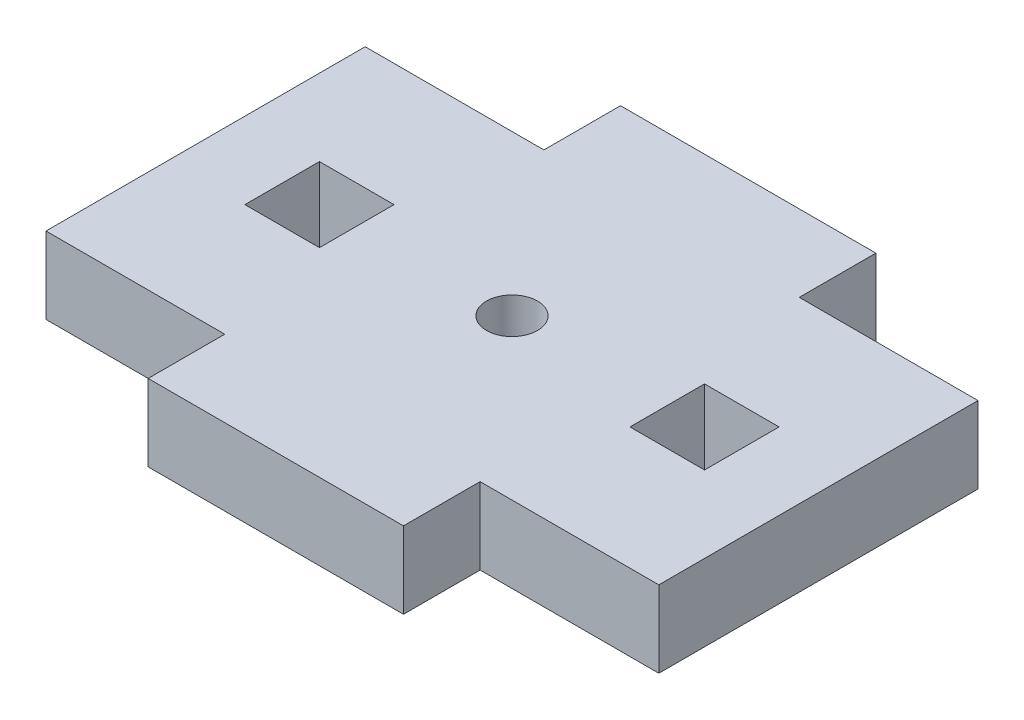
from build123d import *

# Parameters (mm, degrees)
SKETCH1_W           = 10
SKETCH1_H           = 3
BOSS_EXTRUDE1_DEPTH = 3


with BuildPart() as part:
    # Sketch1 → Boss-Extrude1 (new body)
    with BuildSketch(Plane(origin=(0, 0, 0), x_dir=(1, 0, 0), z_dir=(0, 1, 0))):
        with BuildLine():
            Line((9.900990099, -7.357973937), (9.900990099, -1.107973937))
            Line((9.900990099, -1.107973937), (6.900990099, -1.107973937))
            Line((6.900990099, -1.107973937), (6.900990099, -2.567973937))
            Line((6.900990099, -2.567973937), (3.980990099, -2.567973937))
            Line((3.980990099, -2.567973937), (3.980990099, -1.107973937))
            Line((3.980990099, -1.107973937), (-1.099009901, -1.107973937))
            ThreePointArc((-1.099009901, -1.107973937), (-2.099009901, -2.107973937), (-3.099009901, -1.107973937))
            Line((-3.099009901, -1.107973937), (-8.179009901, -1.107973937))
            Line((-8.179009901, -1.107973937), (-8.179009901, -2.567973937))
            Line((-8.179009901, -2.567973937), (-11.099009901, -2.567973937))
            Line((-11.099009901, -2.567973937), (-11.099009901, -1.107973937))
            Line((-11.099009901, -1.107973937), (-14.099009901, -1.107973937))
            Line((-14.099009901, -1.107973937), (-14.099009901, -7.357973937))
            Line((-14.099009901, -7.357973937), (-7.099009901, -7.357973937))
            Line((-7.099009901, -7.357973937), (2.900990099, -7.357973937))
            Line((2.900990099, -7.357973937), (9.900990099, -7.357973937))
        make_face()
        with BuildLine():
            Line((9.900990099, 5.142026063), (2.900990099, 5.142026063))
            Line((2.900990099, 5.142026063), (-7.099009901, 5.142026063))
            Line((-7.099009901, 5.142026063), (-14.099009901, 5.142026063))
            Line((-14.099009901, 5.142026063), (-14.099009901, -1.107973937))
            Line((-14.099009901, -1.107973937), (-11.099009901, -1.107973937))
            Line((-11.099009901, -1.107973937), (-11.099009901, 0.352026063))
            Line((-11.099009901, 0.352026063), (-8.179009901, 0.352026063))
            Line((-8.179009901, 0.352026063), (-8.179009901, -1.107973937))
            Line((-8.179009901, -1.107973937), (-3.099009901, -1.107973937))
            ThreePointArc((-3.099009901, -1.107973937), (-2.099009901, -0.107973937), (-1.099009901, -1.107973937))
            Line((-1.099009901, -1.107973937), (3.980990099, -1.107973937))
            Line((3.980990099, -1.107973937), (3.980990099, 0.352026063))
            Line((3.980990099, 0.352026063), (6.900990099, 0.352026063))
            Line((6.900990099, 0.352026063), (6.900990099, -1.107973937))
            Line((6.900990099, -1.107973937), (9.900990099, -1.107973937))
            Line((9.900990099, -1.107973937), (9.900990099, 5.142026063))
        make_face()
        with Locations((-2.099009901, 6.642026063)):
            Rectangle(SKETCH1_W, SKETCH1_H)
        with Locations((-2.099009901, -8.857973937)):
            Rectangle(SKETCH1_W, SKETCH1_H)
    extrude(amount=BOSS_EXTRUDE1_DEPTH)


solid = part.part
